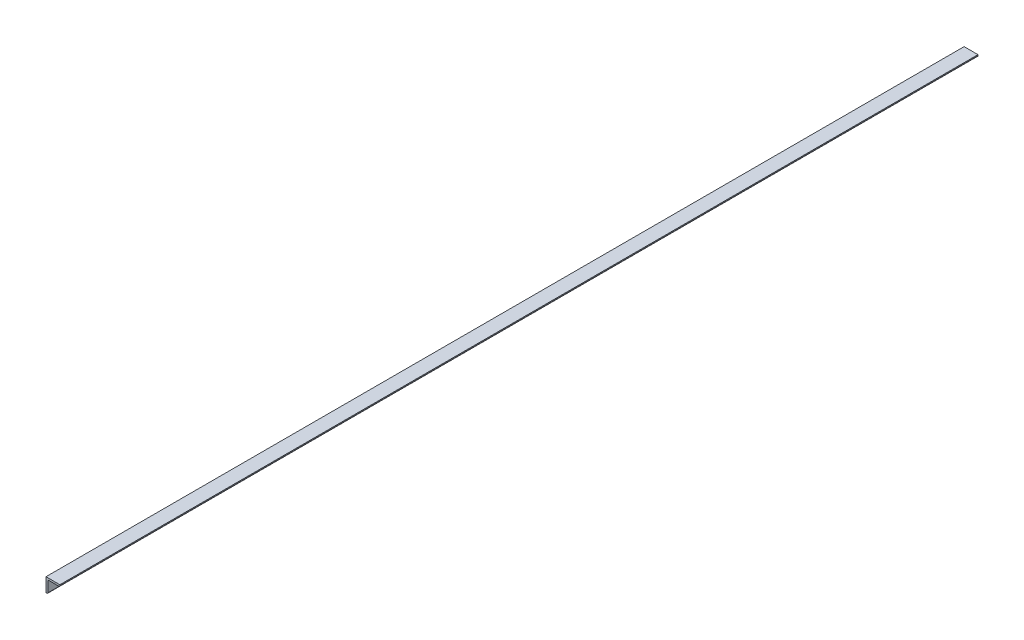
from build123d import *

# Parameters (mm, degrees)
BOSS_EXTRUDE1_DEPTH = 1985


with BuildPart() as part:
    # Sketch1 → Boss-Extrude1 (new body)
    with BuildSketch(Plane.XY):
        with BuildLine():
            Line((-8.625, 38.8125), (-38.625, 38.8125))
            Line((-38.625, 38.8125), (-38.625, 8.8125))
            Line((-38.625, 8.8125), (-36.625, 8.8125))
            ThreePointArc((-36.625, 8.8125), (-35.210786438, 9.398286438), (-34.625, 10.8125))
            Line((-34.625, 10.8125), (-34.625, 32.8125))
            ThreePointArc((-34.625, 32.8125), (-34.039213562, 34.226713562), (-32.625, 34.8125))
            Line((-32.625, 34.8125), (-10.625, 34.8125))
            ThreePointArc((-10.625, 34.8125), (-9.210786438, 35.398286438), (-8.625, 36.8125))
            Line((-8.625, 36.8125), (-8.625, 38.8125))
        make_face()
    extrude(amount=BOSS_EXTRUDE1_DEPTH)


solid = part.part
